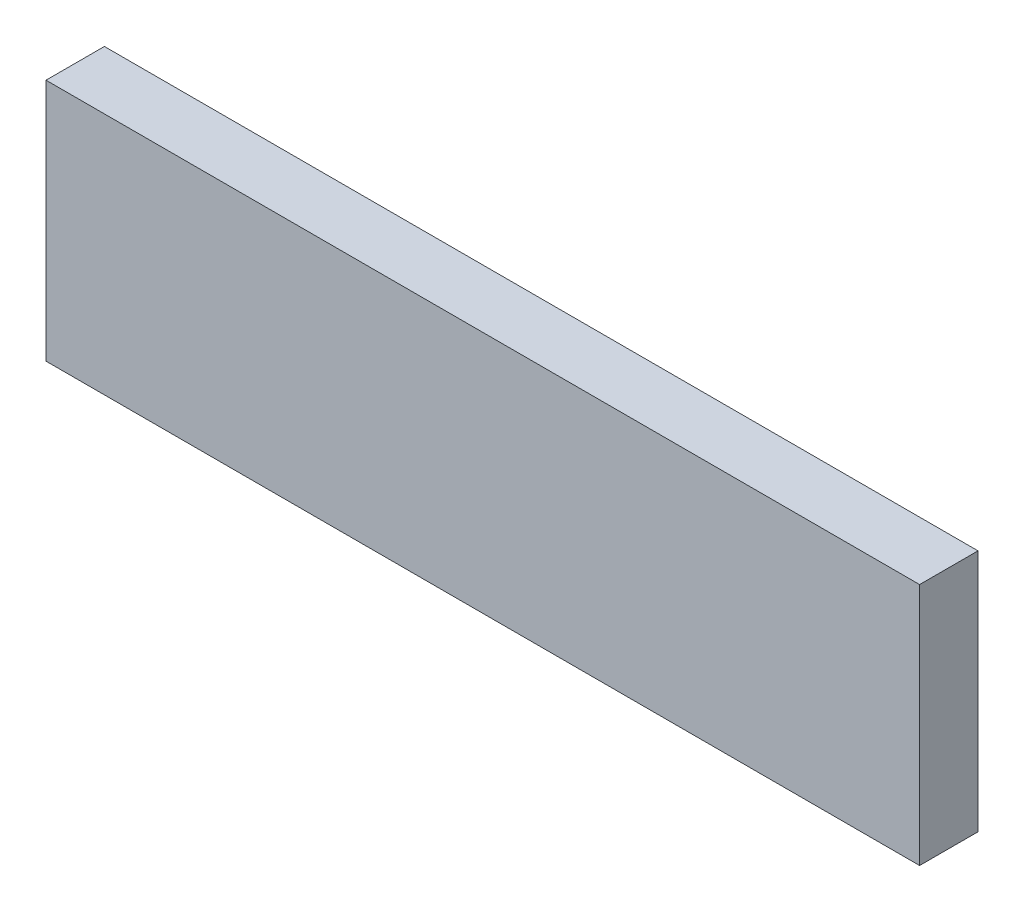
from build123d import *

# Parameters (mm, degrees)
ESBO_O1_W                = 179.5
ESBO_O1_H                = 50
RESSALTO_EXTRUS_O1_DEPTH = 6
ESBO_O2_R                = 1.5
CORTE_EXTRUS_O1_DEPTH    = 15


with BuildPart() as part:
    # Esboço1 → Ressalto-extrusão1 (new, symmetric)
    with BuildSketch(Plane.XY):
        Rectangle(ESBO_O1_W, ESBO_O1_H)
    extrude(amount=RESSALTO_EXTRUS_O1_DEPTH, both=True)

    # Esboço2 → Corte-extrusão1 (cut, symmetric)
    with BuildSketch(Plane(origin=(0, -25, 0), x_dir=(-1, 0, 0), z_dir=(0, -1, 0))):
        with Locations(Location((71.25, 0, 0), (0, 0, 90))):
            Circle(ESBO_O2_R)
        with Locations(Location((-83.75, 0, 0), (0, 0, 90))):
            Circle(ESBO_O2_R)
    extrude(amount=CORTE_EXTRUS_O1_DEPTH, both=True, mode=Mode.SUBTRACT)


solid = part.part
